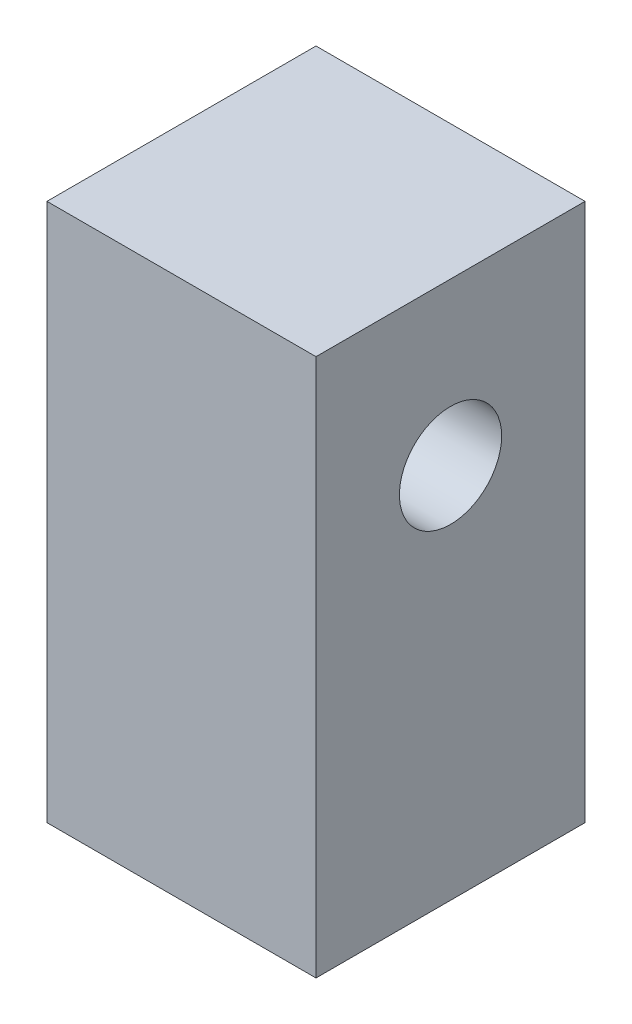
from build123d import *

# Parameters (mm, degrees)
CROQUIS1_W              = 12.7
CROQUIS1_H              = 12.7
SALIENTE_EXTRUIR1_DEPTH = 25.4
CROQUIS3_R              = 2.413
CORTAR_EXTRUIR1_DEPTH   = 25.4


with BuildPart() as part:
    # Croquis1 → Saliente-Extruir1 (new body)
    with BuildSketch(Plane(origin=(0, 0, 0), x_dir=(1, 0, 0), z_dir=(0, 1, 0))):
        Rectangle(CROQUIS1_W, CROQUIS1_H)
    extrude(amount=SALIENTE_EXTRUIR1_DEPTH)

    # Croquis3 → Cortar-Extruir1 (cut)
    with BuildSketch(Plane(origin=(6.35, 0, 0), x_dir=(0, 0, -1), z_dir=(1, 0, 0))):
        with Locations((0, 17.78)):
            Circle(CROQUIS3_R)
    extrude(amount=-CORTAR_EXTRUIR1_DEPTH, mode=Mode.SUBTRACT)


solid = part.part
